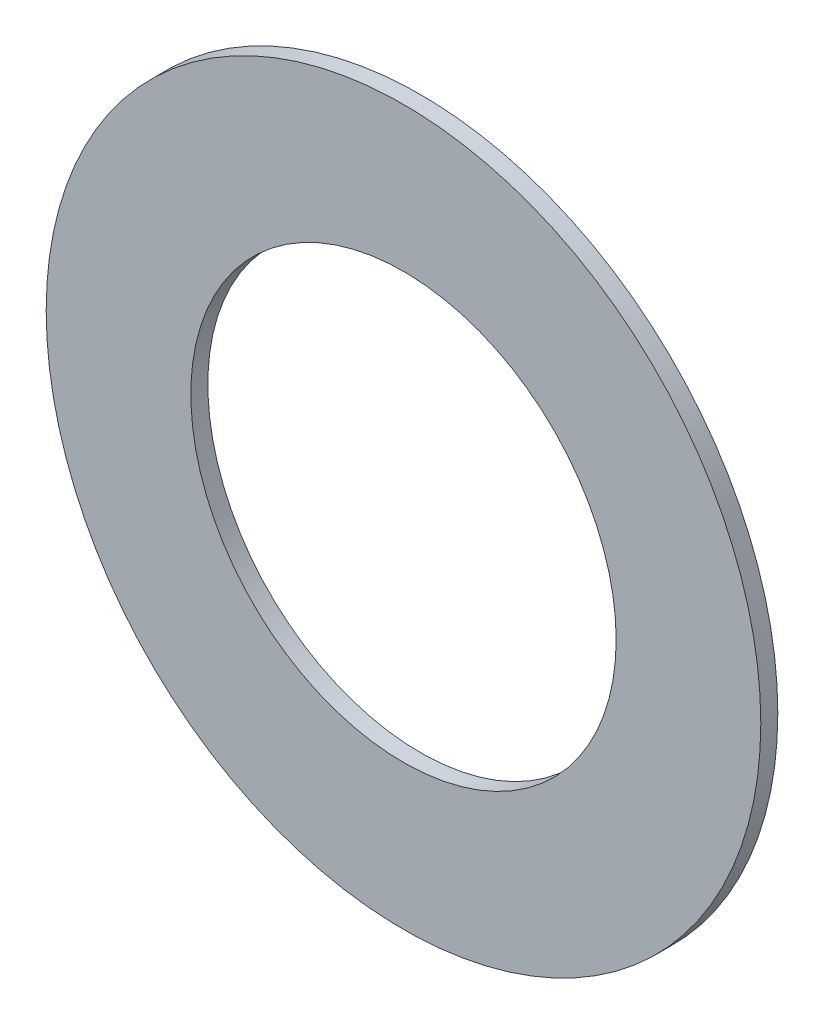
from build123d import *

# Parameters (mm, degrees)
SKETCH_1_R      = 21
SKETCH_1_R_2    = 12.5
EXTRUDE_1_DEPTH = 1


with BuildPart() as part:
    # 草图1 → 凸台-拉伸1 (new body)
    with BuildSketch(Plane.XY):
        Circle(SKETCH_1_R)
        Circle(SKETCH_1_R_2, mode=Mode.SUBTRACT)
    extrude(amount=EXTRUDE_1_DEPTH)


solid = part.part
